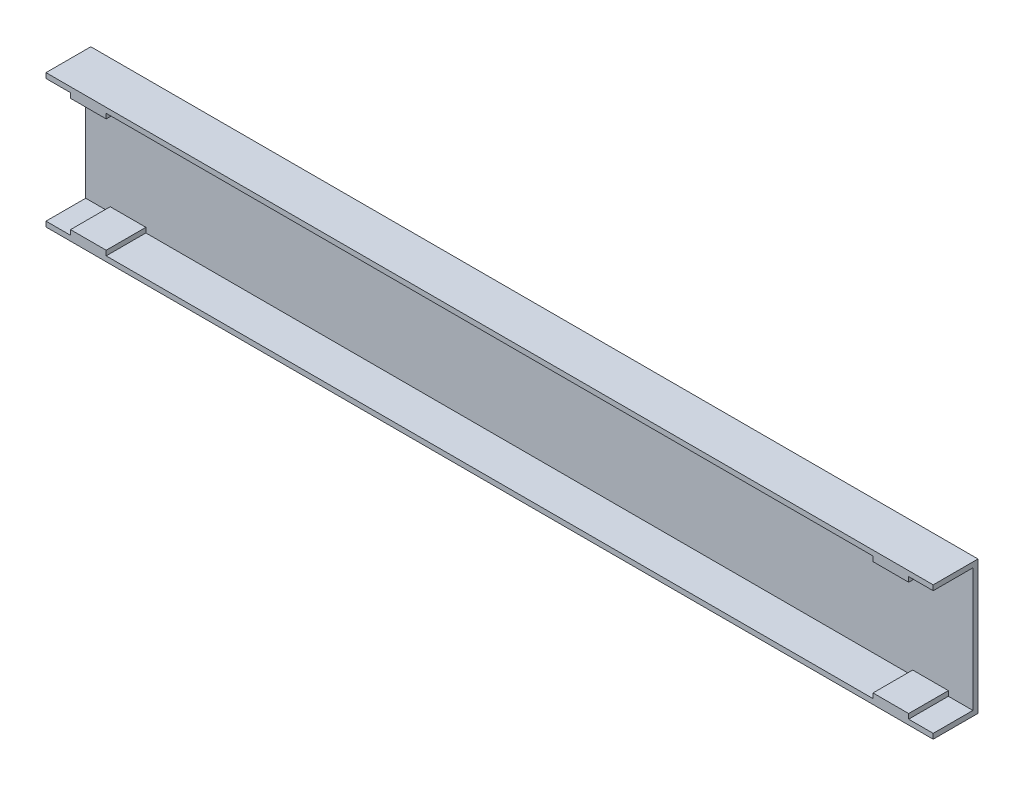
from build123d import *

# Parameters (mm, degrees)
SKETCH_1_W        = 1990
SKETCH_1_H        = 300
EXTRUDE_371_DEPTH = 11.5
EXTRUDE_1_DEPTH   = 89
SKETCH_7_W        = 70
SKETCH_7_H        = 230
SKETCH_7_R        = 13
EXTRUDE_2_DEPTH   = 16


with BuildPart() as part:
    # 草图1 → Extrude 371 (new body)
    with BuildSketch(Plane.XY):
        with Locations((0, 150)):
            Rectangle(SKETCH_1_W, SKETCH_1_H)
    extrude(amount=EXTRUDE_371_DEPTH)

    # 草图2 → 凸台-拉伸1 (add)
    with BuildSketch(Plane.XY.offset(11.5)):
        Polygon((-995, 300), (995, 300), (995, 288.5), (940, 288.5), (940, 277.5), (860, 277.5), (860, 288.5), (-860, 288.5), (-860, 277.5), (-940, 277.5), (-940, 288.5), (-995, 288.5), align=None)
        Polygon((-995, 0), (995, 0), (995, 11.5), (940, 11.5), (940, 22.5), (860, 22.5), (860, 11.5), (-860, 11.5), (-860, 22.5), (-940, 22.5), (-940, 11.5), (-995, 11.5), align=None)
    extrude(amount=EXTRUDE_1_DEPTH)

    # 草图7 → 凸台-拉伸2 (add)
    # profile 1 of 2: a face of its own
    with BuildSketch(Plane(origin=(0, 0, 0), x_dir=(-1, 0, 0), z_dir=(0, 0, -1))):
        with Locations((300, 150)):
            Rectangle(SKETCH_7_W, SKETCH_7_H)
        with Locations((300, 230)):
            Circle(SKETCH_7_R, mode=Mode.SUBTRACT)
        with Locations((300, 150)):
            Circle(SKETCH_7_R, mode=Mode.SUBTRACT)
        with Locations((300, 70)):
            Circle(SKETCH_7_R, mode=Mode.SUBTRACT)
    # profile 2 of 2: a face of its own
    with BuildSketch(Plane(origin=(0, 0, 0), x_dir=(-1, 0, 0), z_dir=(0, 0, -1))):
        with Locations((-300, 150)):
            Rectangle(SKETCH_7_W, SKETCH_7_H)
        with Locations(Location((-300, 70, 0), (0, 0, 180))):
            Circle(SKETCH_7_R, mode=Mode.SUBTRACT)
        with Locations(Location((-300, 150, 0), (0, 0, 180))):
            Circle(SKETCH_7_R, mode=Mode.SUBTRACT)
        with Locations(Location((-300, 230, 0), (0, 0, 180))):
            Circle(SKETCH_7_R, mode=Mode.SUBTRACT)
    extrude(amount=EXTRUDE_2_DEPTH)


solid = part.part
